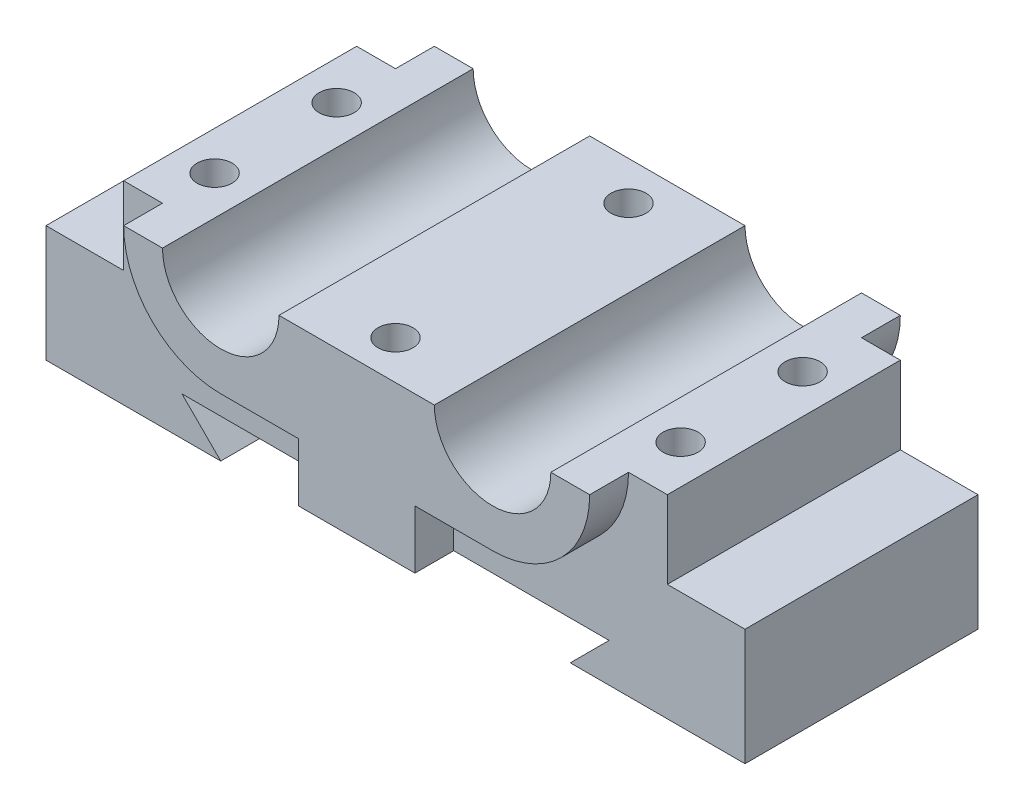
from build123d import *

# Parameters (mm, degrees)
BOSS_EXTRUDE1_DEPTH = 30
BOSS_EXTRUDE2_DEPTH = 5
CUT_EXTRUDE1_START  = -69
CUT_EXTRUDE1_DEPTH  = 69
BOSS_EXTRUDE3_START = 5
BOSS_EXTRUDE3_DEPTH = 5
SKETCH7_R           = 2.25
CUT_EXTRUDE3_DEPTH  = 12.5
SKETCH8_R           = 2.25
CUT_EXTRUDE4_DEPTH  = 12.5


with BuildPart() as part:
    # Sketch1 → Boss-Extrude1 (new body)
    with BuildSketch(Plane.XY):
        Polygon((-27.5, -14.382195086), (27.5, -14.382195086), (22.5, -19.382195086), (45, -19.382195086), (45, -4.382195086), (35, -4.382195086), (35, 5.617804914), (-35, 5.617804914), (-35, -4.382195086), (-45, -4.382195086), (-45, -19.382195086), (-22.5, -19.382195086), align=None)
    extrude(amount=-BOSS_EXTRUDE1_DEPTH)

    # Sketch2 → Boss-Extrude2 (add)
    with BuildSketch(Plane.XY):
        with BuildLine():
            Line((-10, 5.617804914), (10, 5.617804914))
            ThreePointArc((10, 5.617804914), (17.5, -1.882195086), (25, 5.617804914))
            Line((25, 5.617804914), (30, 5.617804914))
            ThreePointArc((30, 5.617804914), (26.338834765, -3.221029851), (17.5, -6.882195086))
            Line((17.5, -6.882195086), (7.5, -6.882195086))
            Line((7.5, -6.882195086), (7.5, -14.382195086))
            Line((7.5, -14.382195086), (-7.5, -14.382195086))
            Line((-7.5, -14.382195086), (-7.5, -6.882195086))
            Line((-7.5, -6.882195086), (-17.5, -6.882195086))
            ThreePointArc((-17.5, -6.882195086), (-26.338834765, -3.221029851), (-30, 5.617804914))
            Line((-30, 5.617804914), (-25, 5.617804914))
            ThreePointArc((-25, 5.617804914), (-17.5, -1.882195086), (-10, 5.617804914))
        make_face()
    extrude(amount=BOSS_EXTRUDE2_DEPTH)

    # Sketch3 → Cut-Extrude1 (cut)
    with BuildSketch(Plane.XY.offset(5).offset(CUT_EXTRUDE1_START)):
        with BuildLine():
            Line((-25, 5.617804914), (-10, 5.617804914))
            ThreePointArc((-10, 5.617804914), (-17.5, -1.882195086), (-25, 5.617804914))
        make_face()
        with BuildLine():
            Line((10, 5.617804914), (25, 5.617804914))
            ThreePointArc((25, 5.617804914), (17.5, -1.882195086), (10, 5.617804914))
        make_face()
    extrude(amount=CUT_EXTRUDE1_DEPTH, mode=Mode.SUBTRACT)

    # Sketch4 → Boss-Extrude3 (add)
    with BuildSketch(Plane(origin=(0, 0, -30), x_dir=(-1, 0, 0), z_dir=(0, 0, -1)).offset(BOSS_EXTRUDE3_START)):
        with BuildLine():
            Line((-17.5, -6.882195086), (-7.5, -6.882195086))
            Line((-7.5, -6.882195086), (-7.5, -14.382195086))
            Line((-7.5, -14.382195086), (7.5, -14.382195086))
            Line((7.5, -14.382195086), (7.5, -6.882195086))
            Line((7.5, -6.882195086), (17.5, -6.882195086))
            ThreePointArc((17.5, -6.882195086), (26.338834765, -3.221029851), (30, 5.617804914))
            Line((30, 5.617804914), (25, 5.617804914))
            ThreePointArc((25, 5.617804914), (17.5, -1.882195086), (10, 5.617804914))
            Line((10, 5.617804914), (-10, 5.617804914))
            ThreePointArc((-10, 5.617804914), (-17.5, -1.882195086), (-25, 5.617804914))
            Line((-25, 5.617804914), (-30, 5.617804914))
            ThreePointArc((-30, 5.617804914), (-26.338834765, -3.221029851), (-17.5, -6.882195086))
        make_face()
    extrude(amount=-BOSS_EXTRUDE3_DEPTH)

    # Sketch7 → Cut-Extrude3 (cut)
    with BuildSketch(Plane(origin=(0, 5.617804914, 0), x_dir=(1, 0, 0), z_dir=(0, 1, 0))):
        with Locations(Location((0, 30, 0), (0, 0, 270))):
            Circle(SKETCH7_R)
        with Locations(Location((0, 0, 0), (0, 0, 270))):
            Circle(SKETCH7_R)
    extrude(amount=-CUT_EXTRUDE3_DEPTH, mode=Mode.SUBTRACT)

    # Sketch8 → Cut-Extrude4 (cut)
    with BuildSketch(Plane(origin=(0, 5.617804914, 0), x_dir=(1, 0, 0), z_dir=(0, 1, 0))):
        with Locations(Location((30, 22.419418388, 0), (0, 0, 270))):
            Circle(SKETCH8_R)
        with Locations(Location((30, 6.707708861, 0), (0, 0, 270))):
            Circle(SKETCH8_R)
        with Locations(Location((-30, 6.707708861, 0), (0, 0, 90))):
            Circle(SKETCH8_R)
        with Locations(Location((-30, 22.419418388, 0), (0, 0, 90))):
            Circle(SKETCH8_R)
    extrude(amount=-CUT_EXTRUDE4_DEPTH, mode=Mode.SUBTRACT)


solid = part.part
